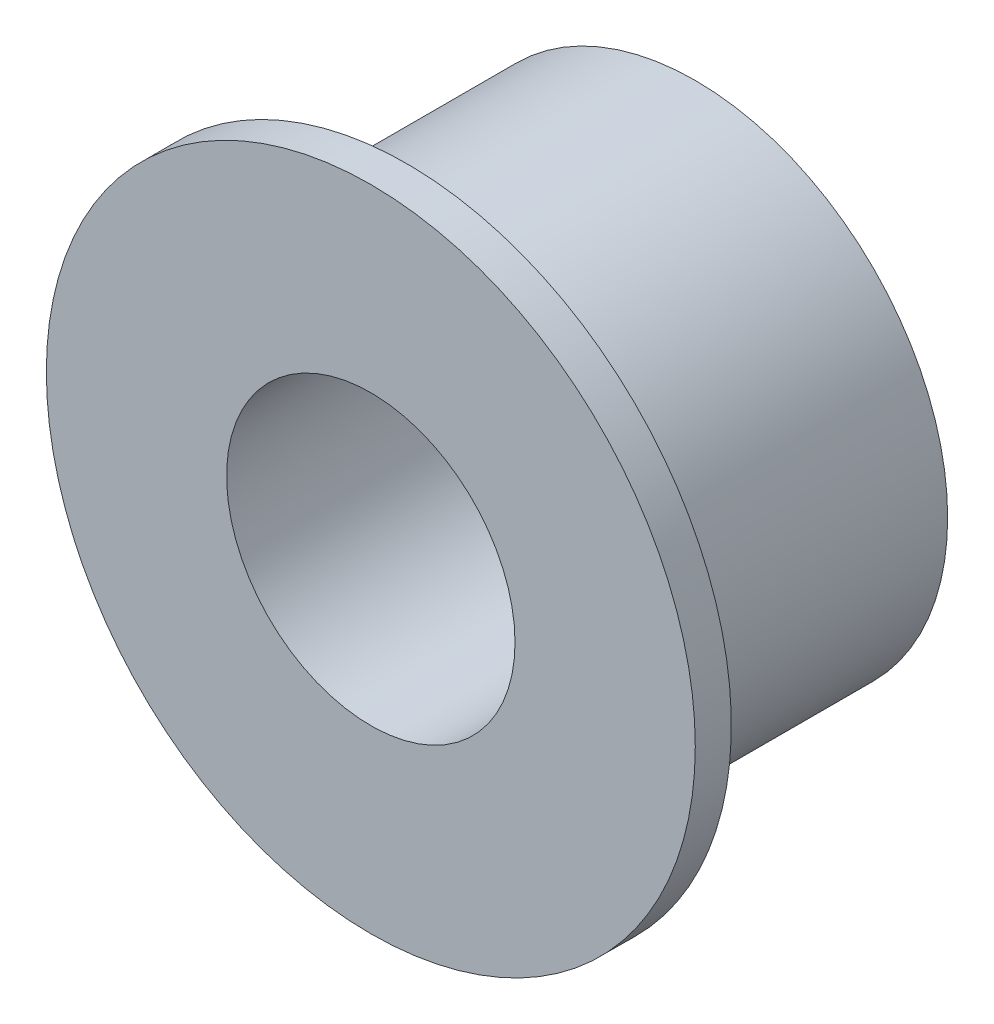
from build123d import *

# Parameters (mm, degrees)
SKETCH2_R           = 9
BOSS_EXTRUDE1_DEPTH = 9
SKETCH3_R           = 4
CUT_EXTRUDE1_DEPTH  = 7
SKETCH4_R           = 9
SKETCH4_R_2         = 7
CUT_EXTRUDE2_DEPTH  = 8


with BuildPart() as part:
    # Sketch2 → Boss-Extrude1 (new body)
    with BuildSketch(Plane.XY):
        Circle(SKETCH2_R)
    extrude(amount=BOSS_EXTRUDE1_DEPTH)

    # Sketch3 → Cut-Extrude1 (cut)
    with BuildSketch(Plane.XY.offset(9)):
        Circle(SKETCH3_R)
    extrude(amount=-CUT_EXTRUDE1_DEPTH, mode=Mode.SUBTRACT)

    # Sketch4 → Cut-Extrude2 (cut)
    with BuildSketch(Plane(origin=(0, 0, 0), x_dir=(-1, 0, 0), z_dir=(0, 0, -1))):
        Circle(SKETCH4_R)
        Circle(SKETCH4_R_2, mode=Mode.SUBTRACT)
    extrude(amount=-CUT_EXTRUDE2_DEPTH, mode=Mode.SUBTRACT)


solid = part.part
